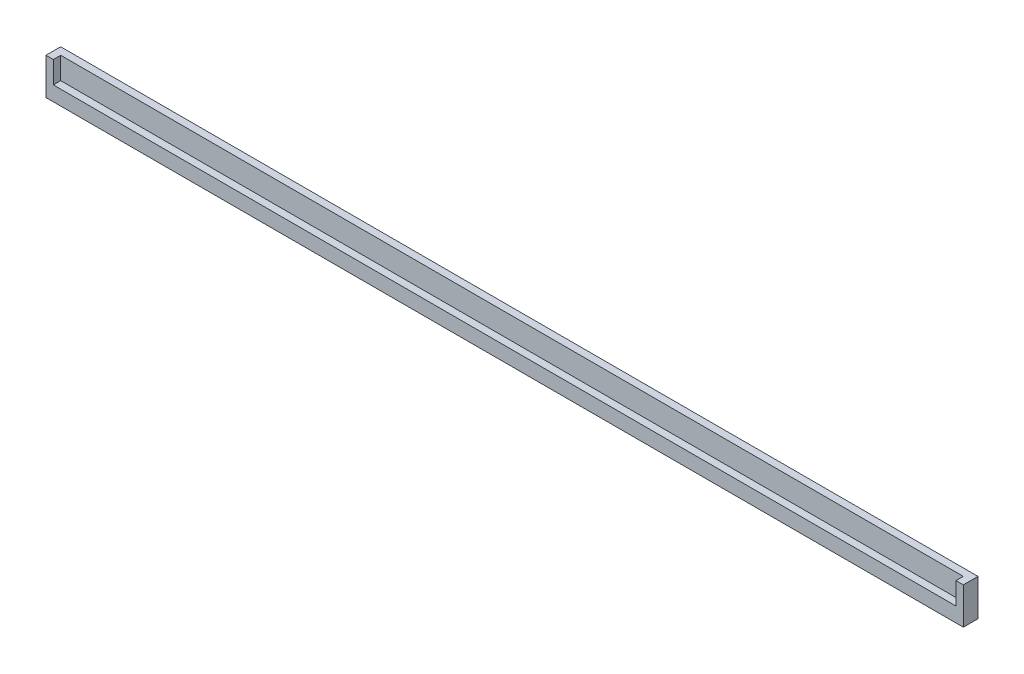
from build123d import *

# Parameters (mm, degrees)
ESQUISSE1_W             = 500
ESQUISSE1_H             = 20
BOSS_EXTRU_1_DEPTH      = 8
ESQUISSE2_W             = 492
ESQUISSE2_H             = 12
ENL_V_MAT_EXTRU_1_DEPTH = 4


with BuildPart() as part:
    # Esquisse1 → Boss.-Extru.1 (new body)
    with BuildSketch(Plane.XY):
        with Locations((134.61480575, -4.325118483)):
            Rectangle(ESQUISSE1_W, ESQUISSE1_H)
    extrude(amount=BOSS_EXTRU_1_DEPTH)

    # Esquisse2 → Enlèv. mat.-Extru.1 (cut)
    with BuildSketch(Plane.XY.offset(8)):
        with Locations((134.61480575, -0.325118483)):
            Rectangle(ESQUISSE2_W, ESQUISSE2_H)
    extrude(amount=-ENL_V_MAT_EXTRU_1_DEPTH, mode=Mode.SUBTRACT)


solid = part.part
